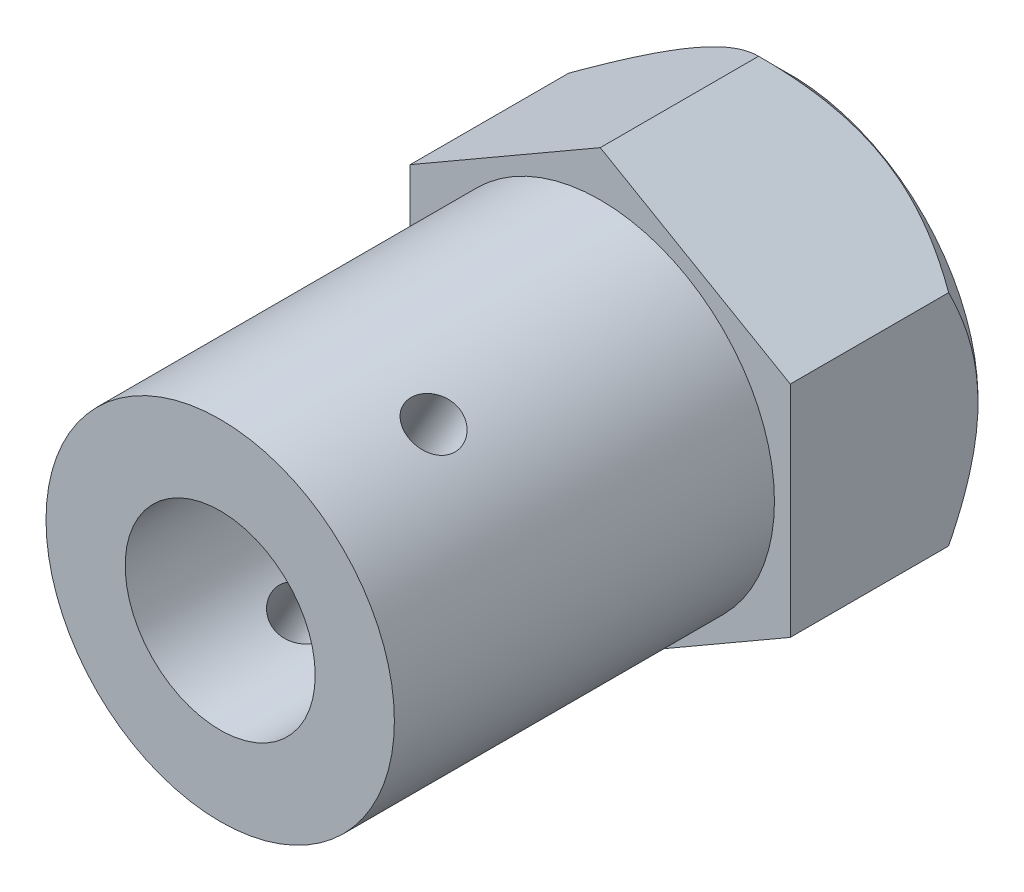
from build123d import *

# Parameters (mm, degrees)
EXTRUDE_1_DEPTH        = 6
SKETCH_2_R             = 5.5
EXTRUDE_2_DEPTH        = 12
HOLE_WIZARD_M3_1_D     = 2.5
HOLE_WIZARD_M3_1_DEPTH = 5.55
HOLE_WIZARD_M3_1_TIP   = 0.751075774
HOLE_WIZARD_M2_2_D     = 1.6
SKETCH_11_R            = 3
CUT_EXTRUDE_1_DEPTH    = 10


with BuildPart() as part:
    # 草图1 → 凸台-拉伸1 (new body)
    with BuildSketch(Plane.XY):
        Polygon((-6, 3.464101615), (0, 6.92820323), (6, 3.464101615), (6, -3.464101615), (0, -6.92820323), (-6, -3.464101615), align=None)
    extrude(amount=EXTRUDE_1_DEPTH)

    # 草图2 → 凸台-拉伸2 (add)
    with BuildSketch(Plane.XY.offset(6)):
        with Locations(Location((0, 0, 0), (0, 0, 180))):
            Circle(SKETCH_2_R)
    extrude(amount=EXTRUDE_2_DEPTH)

    # M3 螺纹孔1
    with Locations(Plane(origin=(0, 0, 0), x_dir=(-1, 0, 0), z_dir=(0, 0, -1))):
        with Locations((0, 0)):
            Hole(HOLE_WIZARD_M3_1_D / 2, depth=HOLE_WIZARD_M3_1_DEPTH)
            with Locations((0, 0, -(HOLE_WIZARD_M3_1_DEPTH + HOLE_WIZARD_M3_1_TIP / 2))):  # 118° drill point
                Cone(0, HOLE_WIZARD_M3_1_D / 2, HOLE_WIZARD_M3_1_TIP, mode=Mode.SUBTRACT)

    # M2 螺纹孔2 (through all)
    with Locations(Plane(origin=(-2.75, -4.763139721, 0), x_dir=(-0.866025403784438, 0.5000000000000011, 0), z_dir=(-0.5000000000000011, -0.8660254037844382, 0))):
        with Locations((0, -14)):
            Hole(HOLE_WIZARD_M2_2_D / 2)

    # 草图10 → 切除-旋转3 (revolve, cut)
    with BuildSketch(Plane(origin=(0, 0, 0), x_dir=(-0.866025403784438, 0.5000000000000011, 0), z_dir=(-0.5000000000000011, -0.8660254037844382, 0)), mode=Mode.PRIVATE) as cut_revolve_3_sk:
        Polygon((6.92820323, 0), (5.92820323, 0), (6.92820323, -1), align=None)
    revolve(cut_revolve_3_sk.sketch.rotate(Axis((0, 0, 0), (0, 0, 1)), 240.000000079), axis=Axis((0, 0, 0), (0, 0, 1)), mode=Mode.SUBTRACT)

    # 草图11 → 切除-拉伸1 (cut)
    with BuildSketch(Plane.XY.offset(18)):
        Circle(SKETCH_11_R)
    extrude(amount=-CUT_EXTRUDE_1_DEPTH, mode=Mode.SUBTRACT)


solid = part.part
